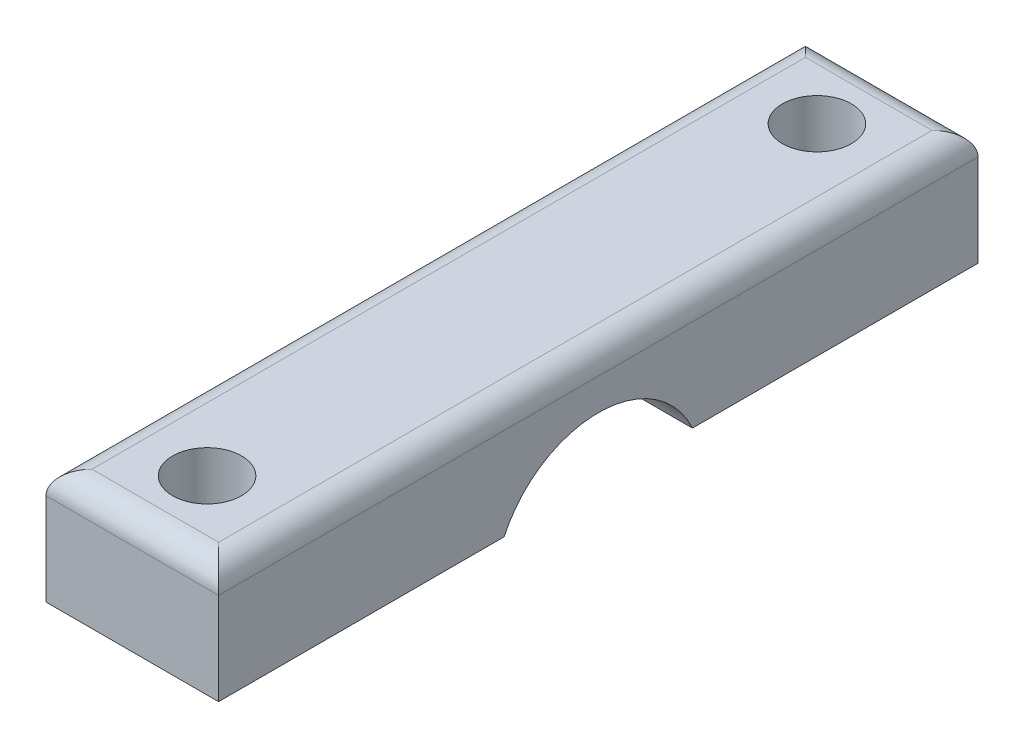
from build123d import *

# Parameters (mm, degrees)
SKETCH1_W           = 15
SKETCH1_H           = 66
SKETCH1_R           = 1.75
BOSS_EXTRUDE1_DEPTH = 10
SKETCH2_R           = 3
CUT_EXTRUDE1_DEPTH  = 6
FILLET1_R           = 2
SKETCH3_R           = 9
CUT_EXTRUDE2_DEPTH  = 15


with BuildPart() as part:
    # Sketch1 → Boss-Extrude1 (new body)
    with BuildSketch(Plane(origin=(0, 0, 0), x_dir=(1, 0, 0), z_dir=(0, 1, 0))):
        with Locations((7.5, 33)):
            Rectangle(SKETCH1_W, SKETCH1_H)
        with Locations(Location((7.5, 59.5, 0), (0, 0, 270))):
            Circle(SKETCH1_R, mode=Mode.SUBTRACT)
        with Locations(Location((7.5, 6.5, 0), (0, 0, 270))):
            Circle(SKETCH1_R, mode=Mode.SUBTRACT)
    extrude(amount=BOSS_EXTRUDE1_DEPTH)

    # Sketch2 → Cut-Extrude1 (cut)
    with BuildSketch(Plane(origin=(0, 10, 0), x_dir=(1, 0, 0), z_dir=(0, 1, 0))):
        with Locations(Location((7.5, 59.5, 0), (0, 0, 270))):
            Circle(SKETCH2_R)
        with Locations(Location((7.5, 6.5, 0), (0, 0, 270))):
            Circle(SKETCH2_R)
    extrude(amount=-CUT_EXTRUDE1_DEPTH, mode=Mode.SUBTRACT)

    # Fillet1
    fillet1_edges = [part.edges().sort_by_distance(p)[0] for p in [
        (15, 10, -33),
        (7.5, 10, -66),
        (0, 10, -33),
        (7.5, 10, 0),
    ]]
    fillet(fillet1_edges, radius=FILLET1_R)

    # Sketch3 → Cut-Extrude2 (cut)
    with BuildSketch(Plane(origin=(15, 0, 0), x_dir=(0, 0, -1), z_dir=(1, 0, 0))):
        with Locations((33, -3.75)):
            Circle(SKETCH3_R)
    extrude(amount=-CUT_EXTRUDE2_DEPTH, mode=Mode.SUBTRACT)


solid = part.part
